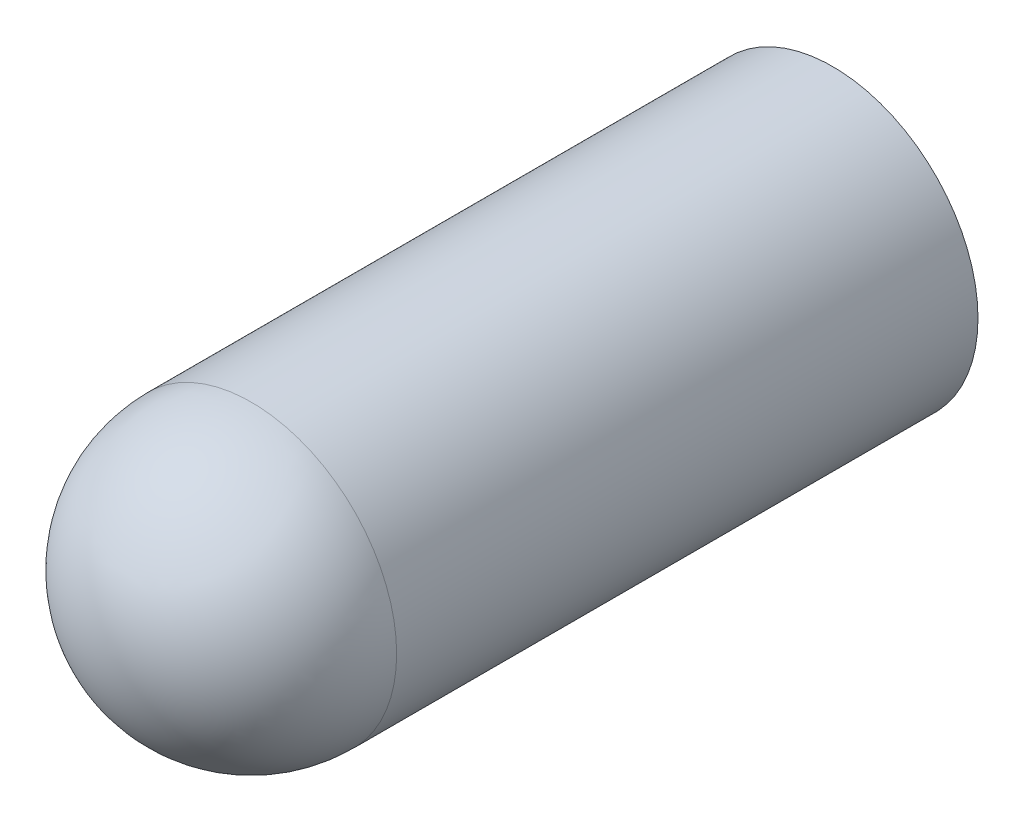
from build123d import *

# Parameters (mm, degrees)
SKETCH_1_R      = 1
EXTRUDE_1_DEPTH = 5
FILLET_1_R      = 1


with BuildPart() as part:
    # 草图1 → 凸台-拉伸1 (new body)
    with BuildSketch(Plane.XY):
        Circle(SKETCH_1_R)
    extrude(amount=EXTRUDE_1_DEPTH)

    # 圆角1
    fillet_1_edges = [part.edges().sort_by_distance(p)[0] for p in [
        (-1, 0, 5),
    ]]
    fillet(fillet_1_edges, radius=FILLET_1_R)


solid = part.part
